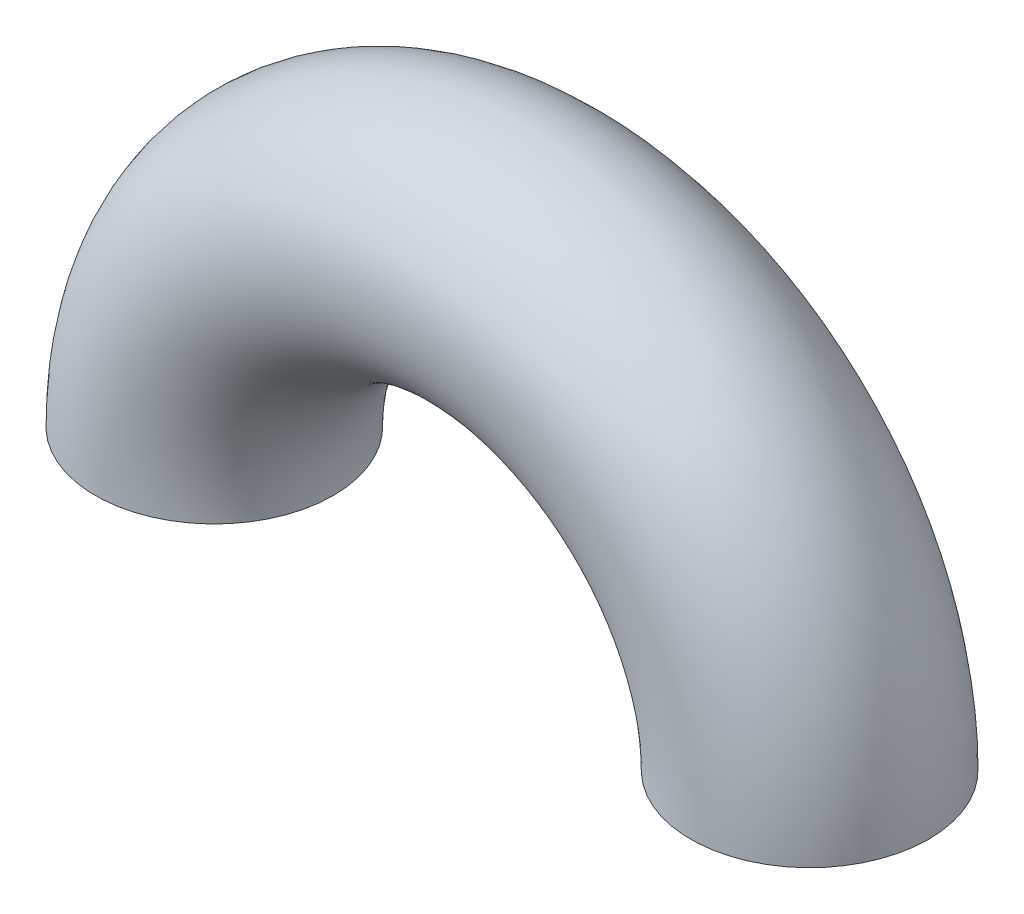
from build123d import *

# Parameters (mm, degrees)
SKETCH2_R = 5
SHELL1_T  = -0.5


with BuildPart() as part:
    # Sweep1: sweep along a path in Sketch3
    with BuildLine(Plane.XY) as sweep1_path:
        ThreePointArc((0, 0), (12.5, 12.5), (25, 0))
    # Sketch2 → Sweep1 (sweep)
    with BuildSketch(Plane(origin=(0, 0, 0), x_dir=(1, 0, 0), z_dir=(0, 1, 0))):
        Circle(SKETCH2_R)
    sweep(path=sweep1_path.line)

    # Shell1
    shell1_openings = [part.faces().sort_by_distance(p)[0] for p in [
        (25, 0, 0),
        (0, 0, 0),
    ]]
    offset(amount=SHELL1_T, openings=shell1_openings, kind=Kind.INTERSECTION)


solid = part.part
